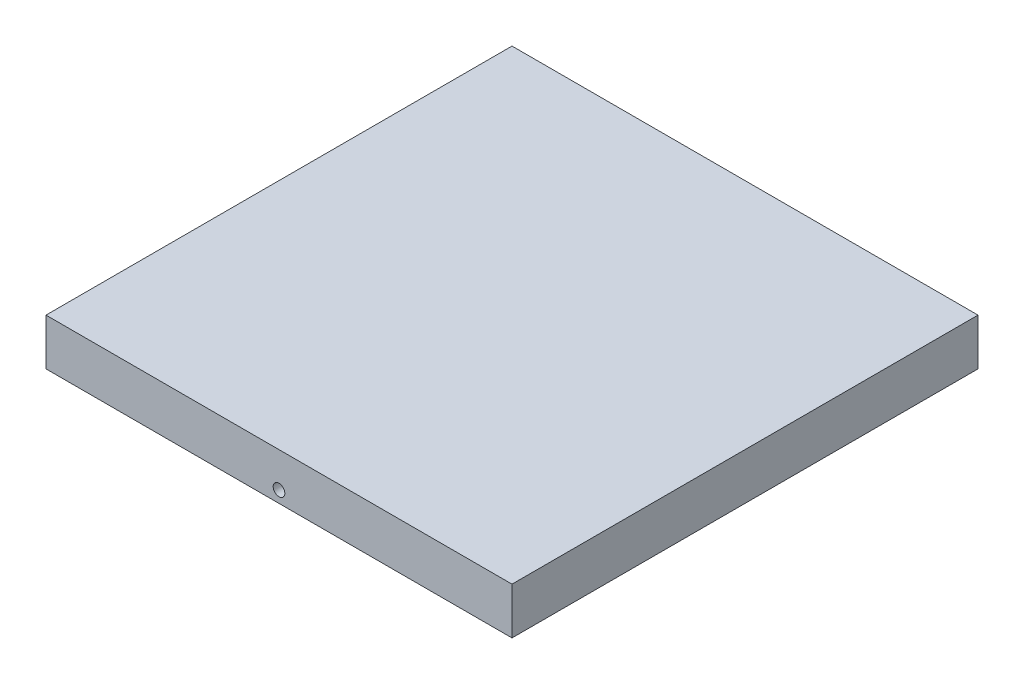
from build123d import *

# Parameters (mm, degrees)
SKETCH1_W           = 127
SKETCH1_H           = 127
BOSS_EXTRUDE1_DEPTH = 12.7
SHELL1_T            = -6.35
SCALE1_SCALE        = 0.5
SKETCH2_R           = 0.79375
CUT_EXTRUDE2_DEPTH  = 69.465251223


with BuildPart() as part:
    # Sketch1 → Boss-Extrude1 (new body)
    with BuildSketch(Plane(origin=(0, 0, 0), x_dir=(1, 0, 0), z_dir=(0, 1, 0))):
        Rectangle(SKETCH1_W, SKETCH1_H)
    extrude(amount=BOSS_EXTRUDE1_DEPTH)

    # Shell1
    shell1_openings = [part.faces().sort_by_distance(p)[0] for p in [
        (0, 0, 0),
    ]]
    offset(amount=SHELL1_T, openings=shell1_openings, kind=Kind.INTERSECTION)


with BuildPart() as part_1:
    # Scale1: scaled about (0, 0, 0)
    add(part.part.scale(SCALE1_SCALE))

    # Sketch2 → Cut-Extrude2 (cut, through all)
    with BuildSketch(Plane(origin=(0, 0, 28.575), x_dir=(-1, 0, 0), z_dir=(0, 0, -1))):
        with Locations((0, 1.5875)):
            Circle(SKETCH2_R)
    extrude(amount=-CUT_EXTRUDE2_DEPTH, mode=Mode.SUBTRACT)


solid = part_1.part
